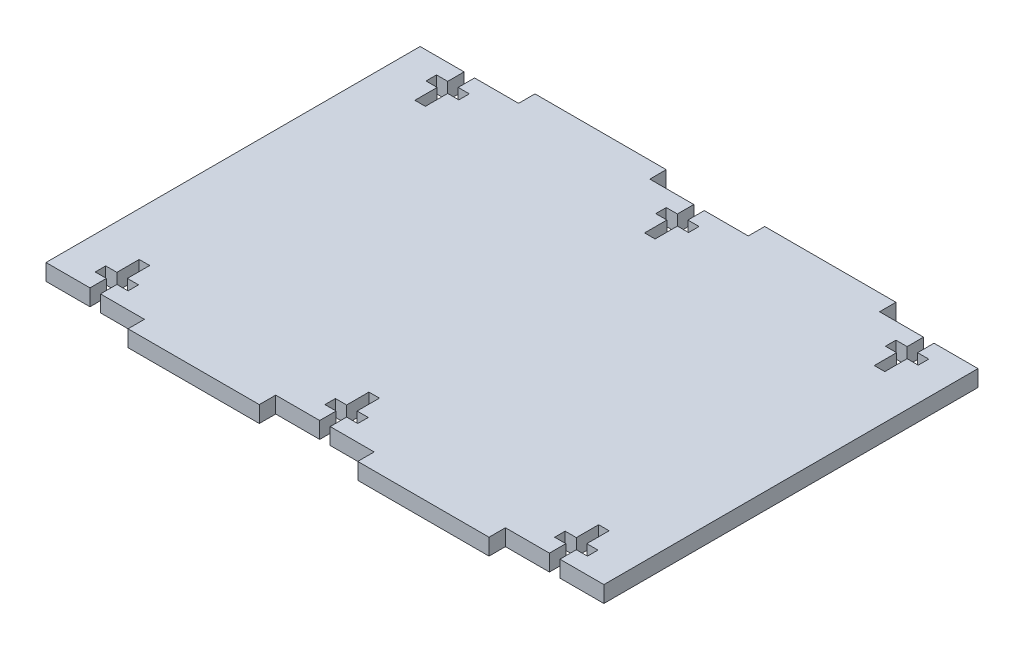
from build123d import *

# Parameters (mm, degrees)
BOSS_EXTRUDE1_DEPTH = 6.35


with BuildPart() as part:
    # Sketch2 → Boss-Extrude1 (new body)
    with BuildSketch(Plane(origin=(0, 0, 0), x_dir=(1, 0, 0), z_dir=(0, 1, 0))):
        Polygon((-107.95, -108.585), (-107.95, 36.195), (-90.932, 36.195), (-90.932, 29.845), (-95.25, 29.845), (-95.25, 25.781), (-90.932, 25.781), (-90.932, 17.145), (-86.868, 17.145), (-86.868, 25.781), (-82.55, 25.781), (-82.55, 29.845), (-86.868, 29.845), (-86.868, 36.195), (-69.85, 36.195), (-69.85, 42.545), (-19.05, 42.545), (-19.05, 36.195), (-2.032, 36.195), (-2.032, 29.845), (-6.35, 29.845), (-6.35, 25.781), (-2.032, 25.781), (-2.032, 17.145), (2.032, 17.145), (2.032, 25.781), (6.35, 25.781), (6.35, 29.845), (2.032, 29.845), (2.032, 36.195), (19.05, 36.195), (19.05, 42.545), (69.85, 42.545), (69.85, 36.195), (86.868, 36.195), (86.868, 29.845), (82.55, 29.845), (82.55, 25.781), (86.868, 25.781), (86.868, 17.145), (90.932, 17.145), (90.932, 25.781), (95.25, 25.781), (95.25, 29.845), (90.932, 29.845), (90.932, 36.195), (107.95, 36.195), (107.95, -108.585), (90.932, -108.585), (90.932, -102.235), (95.25, -102.235), (95.25, -98.171), (90.932, -98.171), (90.932, -89.535), (86.868, -89.535), (86.868, -98.171), (82.55, -98.171), (82.55, -102.235), (86.868, -102.235), (86.868, -108.585), (69.85, -108.585), (69.85, -114.935), (19.05, -114.935), (19.05, -108.585), (2.032, -108.585), (2.032, -102.235), (6.35, -102.235), (6.35, -98.171), (2.032, -98.171), (2.032, -89.535), (-2.032, -89.535), (-2.032, -98.171), (-6.35, -98.171), (-6.35, -102.235), (-2.032, -102.235), (-2.032, -108.585), (-19.05, -108.585), (-19.05, -114.935), (-69.85, -114.935), (-69.85, -108.585), (-86.868, -108.585), (-86.868, -102.235), (-82.55, -102.235), (-82.55, -98.171), (-86.868, -98.171), (-86.868, -89.535), (-90.932, -89.535), (-90.932, -98.171), (-95.25, -98.171), (-95.25, -102.235), (-90.932, -102.235), (-90.932, -108.585), align=None)
    extrude(amount=BOSS_EXTRUDE1_DEPTH)


solid = part.part
